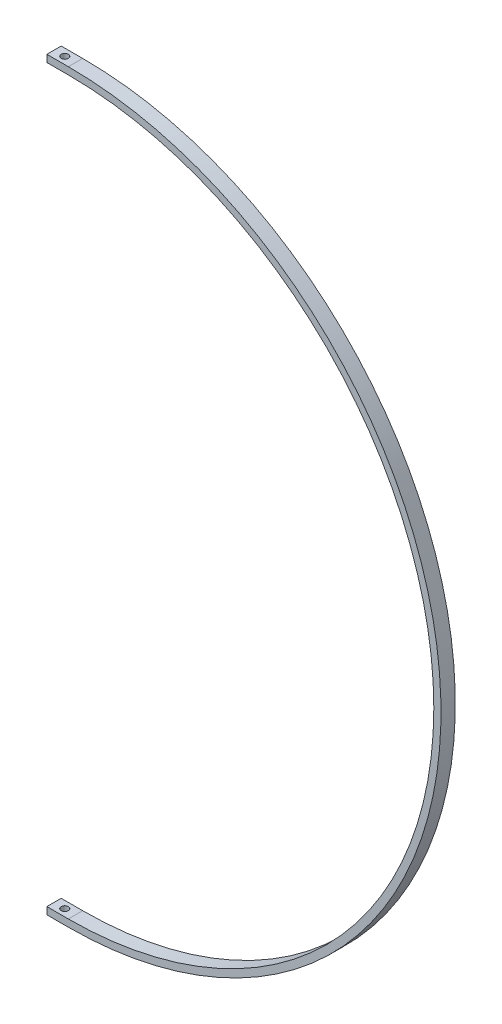
from build123d import *

# Parameters (mm, degrees)
SKETCH1_W           = 12.7
SKETCH1_H           = 6.35
BOSS_EXTRUDE1_DEPTH = 19.05
SKETCH2_R           = 3.175
CUT_EXTRUDE1_DEPTH  = 19.05
SKETCH9_W           = 12.7
SKETCH9_H           = 6.35
REVOLVE1_ANGLE      = 90


with BuildPart() as part:
    # Sketch1 → Boss-Extrude1 (new body)
    with BuildSketch(Plane(origin=(0, 0, 0), x_dir=(0, 0, -1), z_dir=(1, 0, 0))):
        with Locations((0, 327.025)):
            Rectangle(SKETCH1_W, SKETCH1_H)
    extrude(amount=-BOSS_EXTRUDE1_DEPTH)

    # Sketch2 → Cut-Extrude1 (cut)
    with BuildSketch(Plane(origin=(0, 330.2, 0), x_dir=(1, 0, 0), z_dir=(0, 1, 0))):
        with Locations(Location((-9.525, 0, 0), (0, 0, 270))):
            Circle(SKETCH2_R)
    extrude(amount=-CUT_EXTRUDE1_DEPTH, mode=Mode.SUBTRACT)

    # Sketch9 → Revolve1 (revolve)
    with BuildSketch(Plane(origin=(0, 0, 0), x_dir=(0, 0, -1), z_dir=(1, 0, 0))):
        with Locations((0, 327.025)):
            Rectangle(SKETCH9_W, SKETCH9_H)
    revolve(axis=Axis((0, 0, -195.31411855), (0, 0, -1)), revolution_arc=REVOLVE1_ANGLE)

    # Mirror2: part across plane


with BuildPart() as part_1:
    add(part.part)
    add(part.part.mirror(Plane.ZX))


solid = part_1.part
